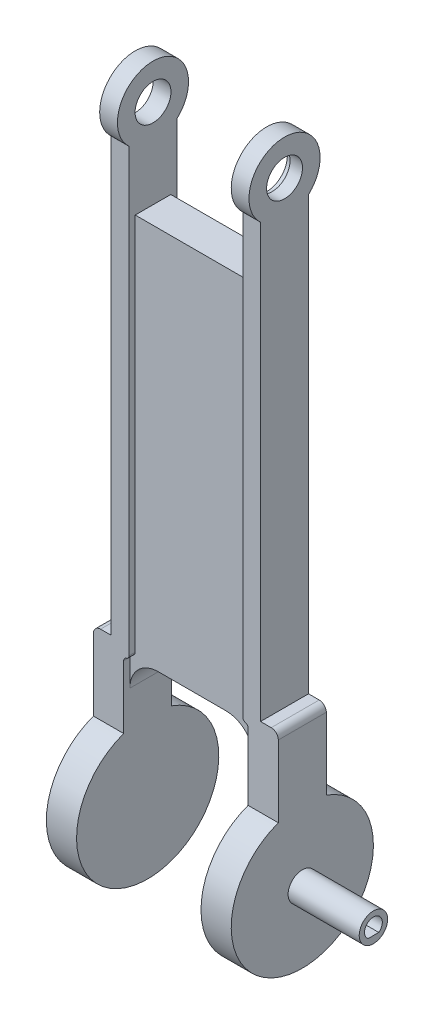
from build123d import *
from build123d.topology import SkipClean

# Parameters (mm, degrees)
SALIENTE_EXTRUIR1_DEPTH    = 10
SALIENTE_EXTRUIR2_DEPTH    = 10
SALIENTE_EXTRUIR3_DEPTH    = 10
SALIENTE_EXTRUIR4_DEPTH    = 1.75
SALIENTE_EXTRUIR5_START    = 1.75
SALIENTE_EXTRUIR5_DEPTH    = 1.75
CROQUIS26_W                = 5
CROQUIS26_H                = 35
SALIENTE_EXTRUIR6_DEPTH    = 1.75
CROQUIS27_W                = 5
CROQUIS27_H                = 35
SALIENTE_EXTRUIR7_DEPTH    = 11.75
CORTAR_EXTRUIR3_DEPTH      = 205.699932829
CORTAR_EXTRUIR3_DEPTH_BACK = 99.75
SALIENTE_EXTRUIR8_START    = -5
SALIENTE_EXTRUIR8_DEPTH    = 5
CROQUIS29_R                = 10
SALIENTE_EXTRUIR9_DEPTH    = 5
CORTAR_EXTRUIR5_DEPTH      = 206.22487666
CORTAR_EXTRUIR5_DEPTH_BACK = 206.22487666
SALIENTE_EXTRUIR11_START   = -8.5
CROQUIS32_R                = 20
SALIENTE_EXTRUIR11_DEPTH   = 8.5
CROQUIS33_R                = 20
SALIENTE_EXTRUIR12_DEPTH   = 8.5
CROQUIS34_R                = 5.05
CORTAR_EXTRUIR6_DEPTH      = 90
CROQUIS39_R                = 5.78
CORTAR_EXTRUIR7_DEPTH      = 1.5
CROQUIS40_R                = 4
SALIENTE_EXTRUIR13_DEPTH   = 20
CROQUIS41_R                = 1.5
CORTAR_EXTRUIR8_DEPTH      = 20


with BuildPart() as part:
    # Croquis1 → Saliente-Extruir1 (new body)
    with BuildSketch(Plane.XY):
        Polygon((0, -143), (0, -35), (-1.6, -35), (-37.4, -35), (-42, -35), (-42, -143), align=None)
    extrude(amount=-SALIENTE_EXTRUIR1_DEPTH)

    # Croquis3 → Saliente-Extruir2 (add)
    with BuildSketch(Plane.XY):
        with BuildLine():
            Line((-47, -141), (-47, -145))
            Line((-47, -145), (-47, -160))
            Line((-47, -160), (-47, -180))
            Line((-47, -180), (-47, -200))
            Line((-47, -200), (-38.5, -200))
            Line((-38.5, -200), (-38.5, -151))
            Line((-38.5, -151), (-38.5, -143))
            Line((-38.5, -143), (-42, -143))
            Line((-42, -143), (-42, -139))
            Line((-42, -139), (-45, -139))
            ThreePointArc((-45, -139), (-46.414213562, -139.585786438), (-47, -141))
        make_face()
        with BuildLine():
            Line((0, -143), (-11.5, -143))
            ThreePointArc((-11.5, -143), (-5.843145751, -145.343145751), (-3.5, -151))
            Line((-3.5, -151), (-3.5, -200))
            Line((-3.5, -200), (5, -200))
            Line((5, -200), (5, -143))
            Line((5, -143), (5, -141))
            ThreePointArc((5, -141), (4.414213562, -139.585786438), (3, -139))
            Line((3, -139), (0, -139))
            Line((0, -139), (0, -143))
        make_face()
    extrude(amount=-SALIENTE_EXTRUIR2_DEPTH)

    # Croquis21 → Saliente-Extruir3 (add)
    with BuildSketch(Plane.XY):
        with BuildLine():
            Line((-38.5, -143), (-38.5, -151))
            ThreePointArc((-38.5, -151), (-36.156854249, -145.343145751), (-30.5, -143))
            Line((-30.5, -143), (-38.5, -143))
        make_face()
    extrude(amount=-SALIENTE_EXTRUIR3_DEPTH)

    # Croquis22 → Saliente-Extruir4 (add)
    with BuildSketch(Plane(origin=(0, 0, -10), x_dir=(-1, 0, 0), z_dir=(0, 0, -1))):
        with BuildLine():
            Line((3.5, -200), (3.5, -156.87358131))
            Line((3.5, -156.87358131), (3.5, -151))
            Line((3.5, -151), (3.5, -141.333778868))
            ThreePointArc((3.5, -141.333778868), (3.709430585, -140.721406432), (4.25, -140.365533031))
            ThreePointArc((4.25, -140.365533031), (4.790569415, -140.00965963), (5, -139.397287194))
            Line((5, -139.397287194), (5, -35))
            Line((5, -35), (0, -35))
            Line((0, -35), (0, -139))
            Line((0, -139), (-3, -139))
            ThreePointArc((-3, -139), (-4.414213562, -139.585786438), (-5, -141))
            Line((-5, -141), (-5, -200))
            Line((-5, -200), (3.5, -200))
        make_face()
        with BuildLine():
            Line((42, -35), (37, -35))
            Line((37, -35), (37, -139.397287194))
            ThreePointArc((37, -139.397287194), (37.209430585, -140.00965963), (37.75, -140.365533031))
            ThreePointArc((37.75, -140.365533031), (38.290569415, -140.721406432), (38.5, -141.333778868))
            Line((38.5, -141.333778868), (38.5, -151))
            Line((38.5, -151), (38.5, -155.512462497))
            Line((38.5, -155.512462497), (38.5, -200))
            Line((38.5, -200), (47, -200))
            Line((47, -200), (47, -141))
            ThreePointArc((47, -141), (46.414213562, -139.585786438), (45, -139))
            Line((45, -139), (42, -139))
            Line((42, -139), (42, -35))
        make_face()
    extrude(amount=SALIENTE_EXTRUIR4_DEPTH)

    # Croquis24 → Saliente-Extruir5 (add)
    with BuildSketch(Plane.XY.offset(SALIENTE_EXTRUIR5_START)):
        with BuildLine():
            Line((-37, -141.498649254), (-37, -35))
            Line((-37, -35), (-42, -35))
            Line((-42, -35), (-42, -139))
            Line((-42, -139), (-45, -139))
            ThreePointArc((-45, -139), (-46.414213562, -139.585786438), (-47, -141))
            Line((-47, -141), (-47, -200))
            Line((-47, -200), (-38.5, -200))
            Line((-38.5, -200), (-38.5, -143.435140927))
            ThreePointArc((-38.5, -143.435140927), (-38.290569415, -142.822768491), (-37.75, -142.466895091))
            ThreePointArc((-37.75, -142.466895091), (-37.209430585, -142.11102169), (-37, -141.498649254))
        make_face()
        with BuildLine():
            Line((0, -35), (-5, -35))
            Line((-5, -35), (-5, -140.397287194))
            ThreePointArc((-5, -140.397287194), (-4.790569415, -141.00965963), (-4.25, -141.365533031))
            ThreePointArc((-4.25, -141.365533031), (-3.709430585, -141.721406432), (-3.5, -142.333778868))
            Line((-3.5, -142.333778868), (-3.5, -200))
            Line((-3.5, -200), (5, -200))
            Line((5, -200), (5, -141))
            ThreePointArc((5, -141), (4.414213562, -139.585786438), (3, -139))
            Line((3, -139), (0, -139))
            Line((0, -139), (0, -35))
        make_face()
    extrude(amount=-SALIENTE_EXTRUIR5_DEPTH)

    # Croquis26 → Saliente-Extruir6 (add)
    with BuildSketch(Plane.XY):
        with Locations((-39.5, -17.5)):
            Rectangle(CROQUIS26_W, CROQUIS26_H)
        with Locations((-2.5, -17.5)):
            Rectangle(CROQUIS26_W, CROQUIS26_H)
    extrude(amount=SALIENTE_EXTRUIR6_DEPTH)

    # Croquis27 → Saliente-Extruir7 (add)
    with BuildSketch(Plane(origin=(0, 0, 0), x_dir=(-1, 0, 0), z_dir=(0, 0, -1))):
        with Locations((2.5, -17.5)):
            Rectangle(CROQUIS27_W, CROQUIS27_H)
        with Locations((39.5, -17.5)):
            Rectangle(CROQUIS27_W, CROQUIS27_H)
    extrude(amount=SALIENTE_EXTRUIR7_DEPTH)

    # Croquis28 → Cortar-Extruir3 (cut, two sides: drawn at the far end of the back side and taken through both)
    with BuildSketch(Plane.ZY.offset(5).offset(-CORTAR_EXTRUIR3_DEPTH_BACK)):
        with BuildLine():
            ThreePointArc((-11.75, -2.621822718), (-8.62065099, -0.678471884), (-5, 0))
            Line((-5, 0), (-11.75, 0))
            Line((-11.75, 0), (-11.75, -2.621822718))
        make_face()
        with BuildLine():
            Line((1.75, -2.621822718), (1.75, 0))
            Line((1.75, 0), (-5, 0))
            ThreePointArc((-5, 0), (-1.37934901, -0.678471884), (1.75, -2.621822718))
        make_face()
    extrude(amount=CORTAR_EXTRUIR3_DEPTH + CORTAR_EXTRUIR3_DEPTH_BACK, mode=Mode.SUBTRACT)

    # Croquis28<5> → Saliente-Extruir8 (add)
    with BuildSketch(Plane.ZY.offset(5).offset(SALIENTE_EXTRUIR8_START)):
        with BuildLine():
            Line((-11.75, -17.378177282), (-11.75, -2.621822718))
            ThreePointArc((-11.75, -2.621822718), (-15, -10), (-11.75, -17.378177282))
        make_face()
        with BuildLine():
            ThreePointArc((5, -10), (4.151502609, -5.968871126), (1.75, -2.621822718))
            Line((1.75, -2.621822718), (1.75, -17.378177282))
            ThreePointArc((1.75, -17.378177282), (4.151502609, -14.031128874), (5, -10))
        make_face()
    extrude(amount=SALIENTE_EXTRUIR8_DEPTH)

    # Croquis29 → Saliente-Extruir9 (add)
    with BuildSketch(Plane(origin=(-37, 0, 0), x_dir=(0, 0, -1), z_dir=(1, 0, 0))):
        with Locations((5, -10)):
            Circle(CROQUIS29_R)
    extrude(amount=-SALIENTE_EXTRUIR9_DEPTH)

    # Croquis31 → Cortar-Extruir5 (cut, two sides: drawn at the far end of the back side and taken through both)
    with BuildSketch(Plane(origin=(-38.5, 0, 0), x_dir=(0, 0, -1), z_dir=(1, 0, 0)).offset(-CORTAR_EXTRUIR5_DEPTH_BACK)):
        with BuildLine():
            Line((-1.75, -200), (5, -200))
            ThreePointArc((5, -200), (1.574376792, -199.704443804), (-1.75, -198.826510564))
            Line((-1.75, -198.826510564), (-1.75, -200))
        make_face()
        with BuildLine():
            Line((11.75, -200), (11.75, -198.826510564))
            ThreePointArc((11.75, -198.826510564), (8.425623208, -199.704443804), (5, -200))
            Line((5, -200), (11.75, -200))
        make_face()
    extrude(amount=CORTAR_EXTRUIR5_DEPTH + CORTAR_EXTRUIR5_DEPTH_BACK, mode=Mode.SUBTRACT)

    # Croquis32 → Saliente-Extruir11 (add)
    with BuildSketch(Plane(origin=(-38.5, 0, 0), x_dir=(0, 0, -1), z_dir=(1, 0, 0)).offset(SALIENTE_EXTRUIR11_START)):
        with Locations((5, -180)):
            Circle(CROQUIS32_R)
    extrude(amount=SALIENTE_EXTRUIR11_DEPTH)

    # Croquis33 → Saliente-Extruir12 (add)
    with BuildSketch(Plane.ZY.offset(3.5)):
        with Locations((-5, -180)):
            Circle(CROQUIS33_R)
    extrude(amount=-SALIENTE_EXTRUIR12_DEPTH)

    # Croquis34 → Cortar-Extruir6 (cut)
    with BuildSketch(Plane.ZY.offset(42)):
        with Locations(Location((-5, -10, 0), (0, 0, 270))):
            Circle(CROQUIS34_R)
    extrude(amount=-CORTAR_EXTRUIR6_DEPTH, mode=Mode.SUBTRACT)

    # Croquis39 → Cortar-Extruir7 (cut)
    with SkipClean():  # the faces are left unmerged after this step: merging them gives an invalid solid
        with BuildSketch(Plane.ZY.offset(5)):
            with Locations(Location((-5, -10, 0), (0, 0, 270))):
                Circle(CROQUIS39_R)
        extrude(amount=-CORTAR_EXTRUIR7_DEPTH, mode=Mode.SUBTRACT)

    # Croquis40 → Saliente-Extruir13 (add)
    with SkipClean():  # the faces are left unmerged after this step: merging them gives an invalid solid
        with BuildSketch(Plane(origin=(5, 0, 0), x_dir=(0, 0, -1), z_dir=(1, 0, 0))):
            with Locations(Location((5, -180, 0), (0, 0, 270))):
                Circle(CROQUIS40_R)
            with BuildLine():
                Line((6.5, -182), (3.5, -182))
                ThreePointArc((3.5, -182), (5, -177.5), (6.5, -182))
            make_face(mode=Mode.SUBTRACT)
        extrude(amount=SALIENTE_EXTRUIR13_DEPTH)

    # Croquis41 → Cortar-Extruir8 (cut)
    with SkipClean():  # the faces are left unmerged after this step: merging them gives an invalid solid
        with BuildSketch(Plane(origin=(0, -182, 0), x_dir=(1, 0, 0), z_dir=(0, 1, 0))):
            with Locations(Location((18.048745385, 5, 0), (0, 0, 270))):
                Circle(CROQUIS41_R)
            with Locations(Location((12.048745385, 5, 0), (0, 0, 270))):
                Circle(CROQUIS41_R)
        extrude(amount=-CORTAR_EXTRUIR8_DEPTH, mode=Mode.SUBTRACT)


solid = part.part
